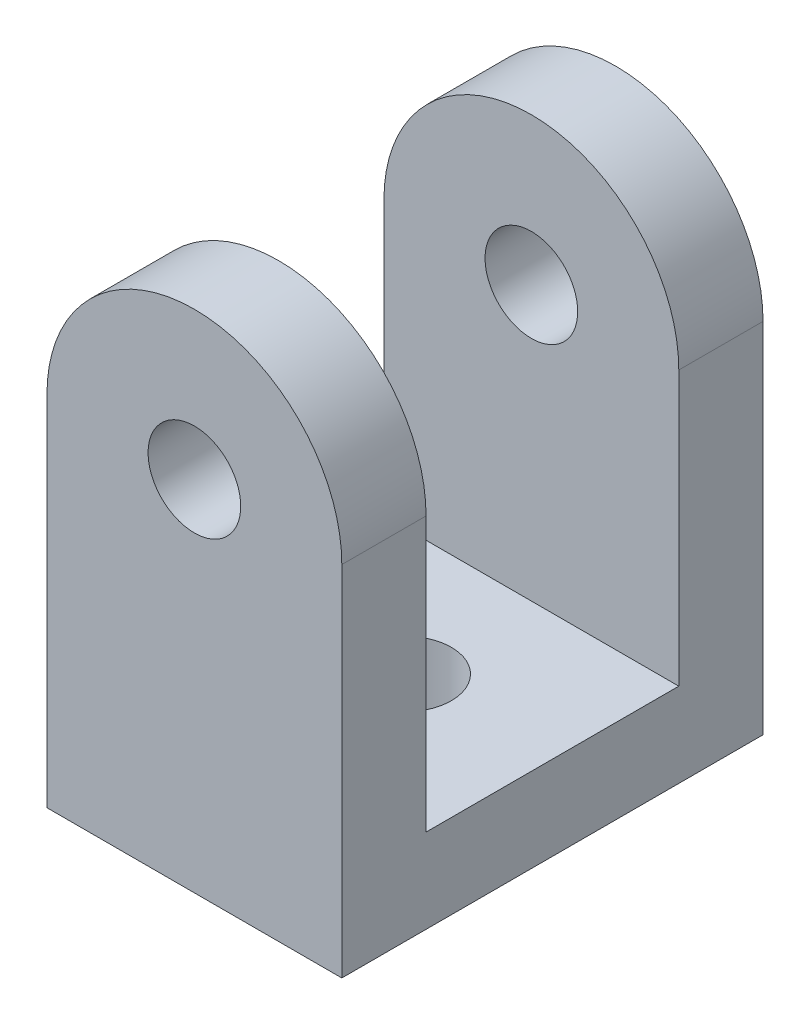
from build123d import *

# Parameters (mm, degrees)
SKETCH_1_W          = 7
SKETCH_1_H          = 10
EXTRUDE_1_DEPTH     = 2
SKETCH_2_W          = 7
SKETCH_2_H          = 2
EXTRUDE_2_DEPTH     = 10
FILLET_1_RADIUS     = 3.5
FILLET_1_LENGTH     = 2
FILLET_2_RADIUS     = 3.5
FILLET_2_LENGTH     = 2
SKETCH_3_R          = 1.1
CUT_EXTRUDE_1_DEPTH = 25
SKETCH_4_R          = 1.1
CUT_EXTRUDE_2_DEPTH = 25


with BuildPart() as part:
    # 草图1 → 凸台-拉伸1 (new body)
    with BuildSketch(Plane(origin=(0, 0, 0), x_dir=(1, 0, 0), z_dir=(0, 1, 0))):
        Rectangle(SKETCH_1_W, SKETCH_1_H)
    extrude(amount=EXTRUDE_1_DEPTH)

    # 草图2 → 凸台-拉伸2 (add)
    with BuildSketch(Plane(origin=(0, 2, 0), x_dir=(1, 0, 0), z_dir=(0, 1, 0))):
        with Locations((0, -4)):
            Rectangle(SKETCH_2_W, SKETCH_2_H)
        with Locations((0, 4)):
            Rectangle(SKETCH_2_W, SKETCH_2_H)
    extrude(amount=EXTRUDE_2_DEPTH)

    # 圆角1: full round fillet: the end face becomes a half cylinder, R = half its width
    fillet_1_face = Plane((0, 12, 4), x_dir=(0, 0, 1), z_dir=(0, 1, 0))  # on the end face: x along it, z out of the body
    fillet_1_slab = fillet_1_face.offset(-FILLET_1_RADIUS / 2) * Box(FILLET_1_LENGTH, 2 * FILLET_1_RADIUS, FILLET_1_RADIUS, mode=Mode.PRIVATE)  # the body's end, R deep
    fillet_1_round = Plane((0, 8.5, 4), x_dir=(0, 1, 0), z_dir=(0, 0, 1)) * Cylinder(FILLET_1_RADIUS, FILLET_1_LENGTH, mode=Mode.PRIVATE)  # its axis R under the face
    add(fillet_1_slab - fillet_1_round, mode=Mode.SUBTRACT)

    # 圆角2: full round fillet: the end face becomes a half cylinder, R = half its width
    fillet_2_face = Plane((0, 12, -4), x_dir=(0, 0, 1), z_dir=(0, 1, 0))  # on the end face: x along it, z out of the body
    fillet_2_slab = fillet_2_face.offset(-FILLET_2_RADIUS / 2) * Box(FILLET_2_LENGTH, 2 * FILLET_2_RADIUS, FILLET_2_RADIUS, mode=Mode.PRIVATE)  # the body's end, R deep
    fillet_2_round = Plane((0, 8.5, -4), x_dir=(0, 1, 0), z_dir=(0, 0, 1)) * Cylinder(FILLET_2_RADIUS, FILLET_2_LENGTH, mode=Mode.PRIVATE)  # its axis R under the face
    add(fillet_2_slab - fillet_2_round, mode=Mode.SUBTRACT)

    # 草图3 → 切除-拉伸1 (cut)
    with BuildSketch(Plane(origin=(0, 0, -5), x_dir=(-1, 0, 0), z_dir=(0, 0, -1))):
        with Locations((0, 8.5)):
            Circle(SKETCH_3_R)
    extrude(amount=-CUT_EXTRUDE_1_DEPTH, mode=Mode.SUBTRACT)

    # 草图4 → 切除-拉伸2 (cut)
    with BuildSketch(Plane(origin=(0, 2, 0), x_dir=(1, 0, 0), z_dir=(0, 1, 0))):
        with Locations(Location((0, 0, 0), (0, 0, 270))):
            Circle(SKETCH_4_R)
    extrude(amount=-CUT_EXTRUDE_2_DEPTH, mode=Mode.SUBTRACT)


solid = part.part
